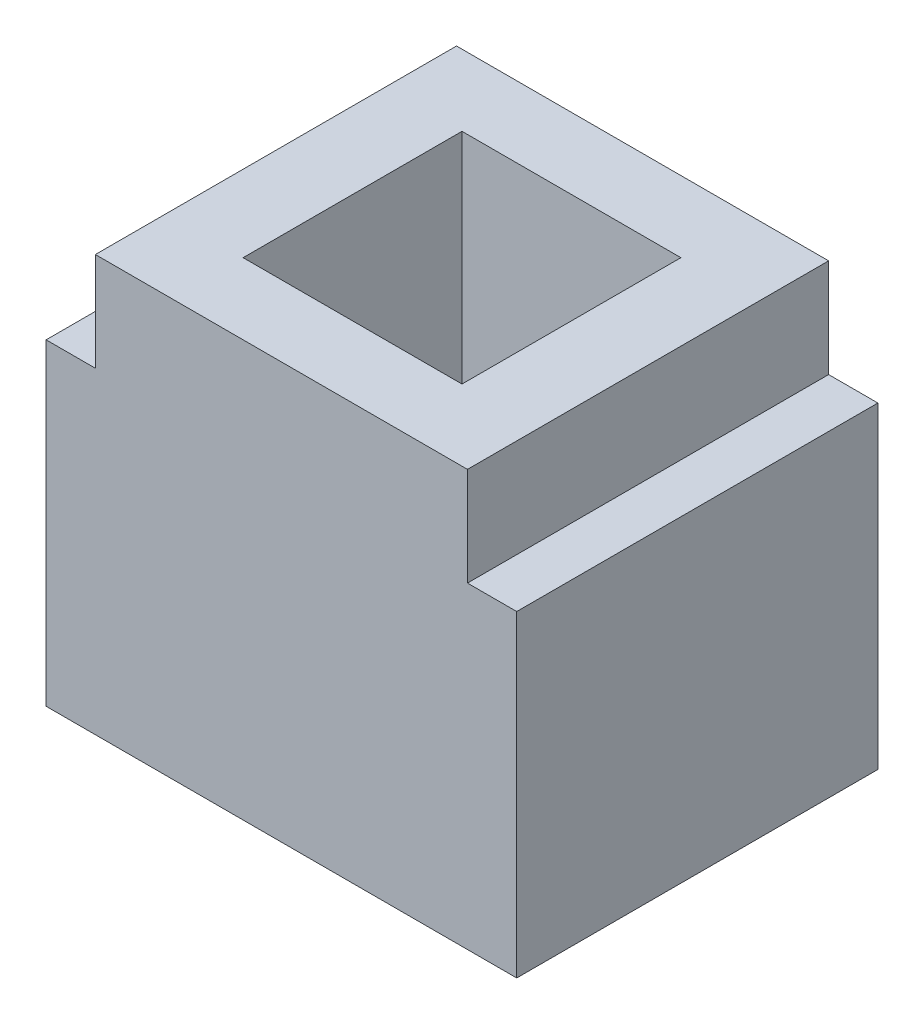
from build123d import *

# Parameters (mm, degrees)
SALIENTE_EXTRUIR1_DEPTH = 66
CROQUIS2_W              = 40
CROQUIS2_H              = 40
CORTAR_EXTRUIR1_DEPTH   = 50


with BuildPart() as part:
    # Croquis1 → Saliente-Extruir1 (new body)
    with BuildSketch(Plane.XY):
        Polygon((-43, -29), (43, -29), (43, 29), (34, 29), (34, 47), (-34, 47), (-34, 29), (-43, 29), align=None)
    extrude(amount=-SALIENTE_EXTRUIR1_DEPTH)

    # Croquis2 → Cortar-Extruir1 (cut)
    with BuildSketch(Plane(origin=(0, 47, 0), x_dir=(1, 0, 0), z_dir=(0, 1, 0))):
        with Locations((0, 33)):
            Rectangle(CROQUIS2_W, CROQUIS2_H)
    extrude(amount=-CORTAR_EXTRUIR1_DEPTH, mode=Mode.SUBTRACT)


solid = part.part
